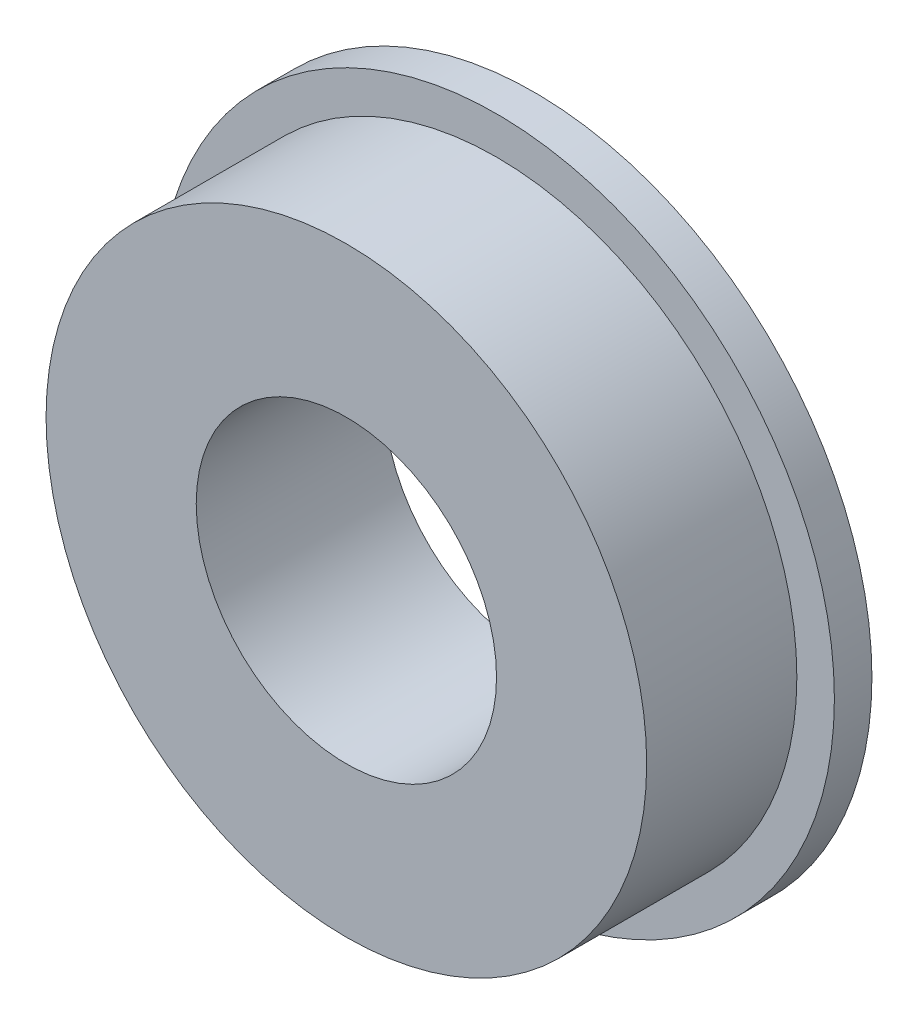
from build123d import *

# Parameters (mm, degrees)
SKETCH_1_R          = 9
SKETCH_1_R_2        = 4
EXTRUDE_1_DEPTH     = 5
CUT_EXTRUDE_START   = -4
SKETCH_2_R          = 9
SKETCH_2_R_2        = 8
CUT_EXTRUDE_1_DEPTH = 4


with BuildPart() as part:
    # Эскиз1 → Бобышка-Вытянуть1 (new body)
    with BuildSketch(Plane.XY):
        Circle(SKETCH_1_R)
        Circle(SKETCH_1_R_2, mode=Mode.SUBTRACT)
    extrude(amount=EXTRUDE_1_DEPTH)

    # Эскиз2 → Вырез-Вытянуть1 (cut)
    with BuildSketch(Plane.XY.offset(5).offset(CUT_EXTRUDE_START)):
        Circle(SKETCH_2_R)
        Circle(SKETCH_2_R_2, mode=Mode.SUBTRACT)
    extrude(amount=CUT_EXTRUDE_1_DEPTH, mode=Mode.SUBTRACT)


solid = part.part
